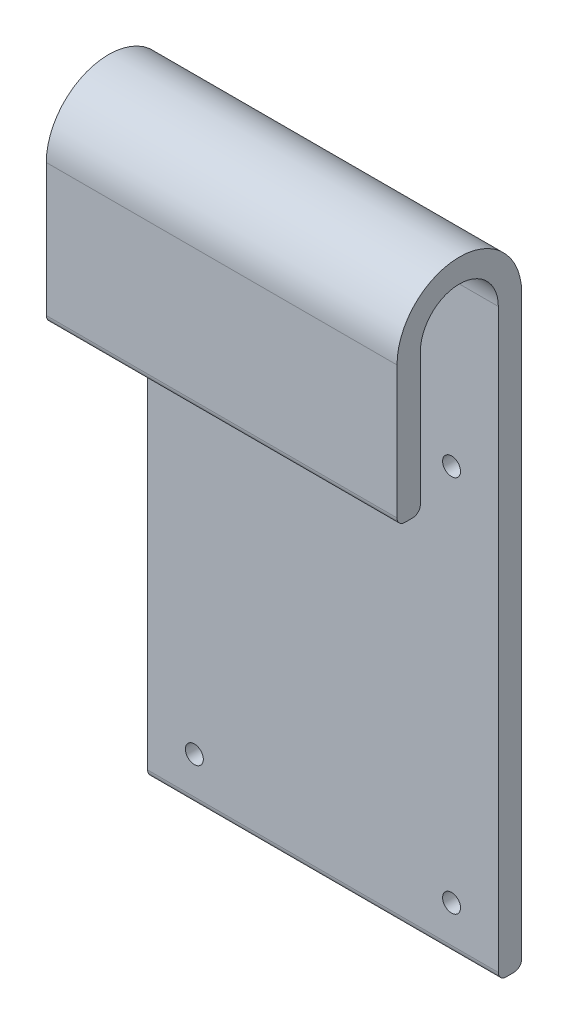
from build123d import *

# Parameters (mm, degrees)
EXTRUDE_THIN1_DEPTH = 22.5
SKETCH2_R           = 1.15
CUT_EXTRUDE1_DEPTH  = 88.471423905
FILLET1_R           = 1


with BuildPart() as part:
    # Sketch1 → Extrude-Thin1 (new, symmetric)
    with BuildSketch(Plane(origin=(0, 0, 0), x_dir=(0, 0, -1), z_dir=(1, 0, 0))):
        with BuildLine():
            Line((0, 0), (0, 75))
            ThreePointArc((0, 75), (-5, 80), (-10, 75))
            Line((-10, 75), (-10, 57))
            Line((-10, 57), (-13, 57))
            Line((-13, 57), (-13, 75))
            ThreePointArc((-13, 75), (-5, 83), (3, 75))
            Line((3, 75), (3, 0))
            Line((3, 0), (0, 0))
        make_face()
    extrude(amount=EXTRUDE_THIN1_DEPTH, both=True)

    # Sketch2 → Cut-Extrude1 (cut, through all)
    with BuildSketch(Plane(origin=(0, 0, -3), x_dir=(-1, 0, 0), z_dir=(0, 0, -1))):
        with Locations((-16.5, 54.245785589)):
            Circle(SKETCH2_R)
        with Locations((16.5, 54.245785589)):
            Circle(SKETCH2_R)
        with Locations((16.5, 5.745785589)):
            Circle(SKETCH2_R)
        with Locations((-16.5, 5.745785589)):
            Circle(SKETCH2_R)
    extrude(amount=-CUT_EXTRUDE1_DEPTH, mode=Mode.SUBTRACT)

    # Fillet1
    fillet1_edges = [part.edges().sort_by_distance(p)[0] for p in [
        (0, 0, -3),
        (0, 0, 0),
        (0, 57, 10),
        (0, 57, 13),
    ]]
    fillet(fillet1_edges, radius=FILLET1_R)


solid = part.part
